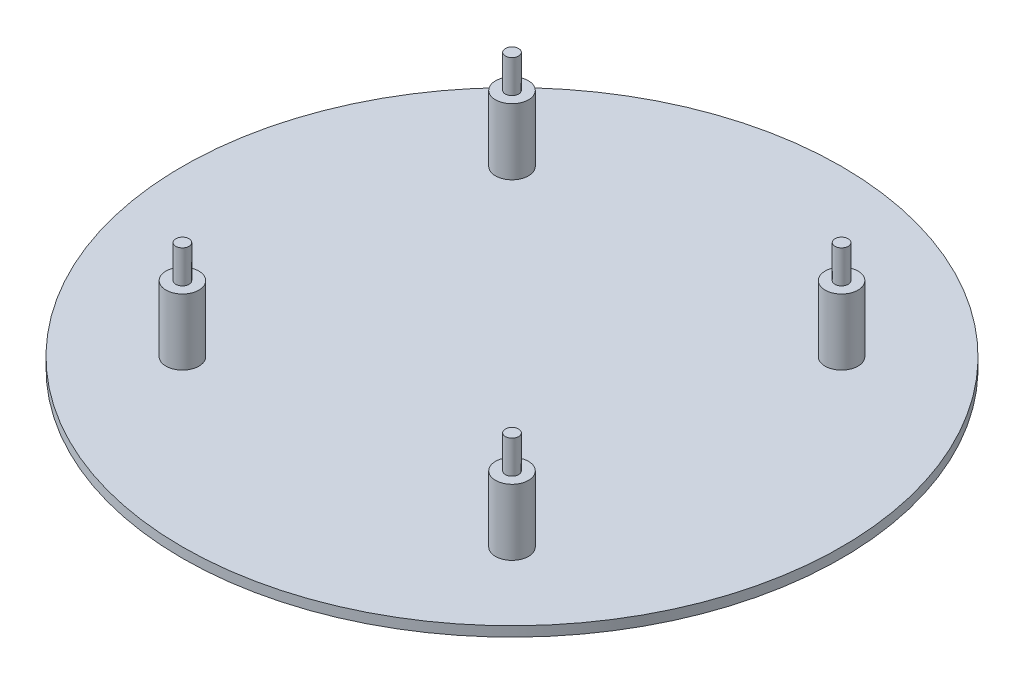
from build123d import *

# Parameters (mm, degrees)
SKETCH3_R           = 100
BOSS_EXTRUDE1_DEPTH = 3
SKETCH4_R           = 5
BOSS_EXTRUDE2_DEPTH = 20
SKETCH5_R           = 2
BOSS_EXTRUDE3_DEPTH = 10


with BuildPart() as part:
    # Sketch3 → Boss-Extrude1 (new body)
    with BuildSketch(Plane(origin=(0, 0, 0), x_dir=(1, 0, 0), z_dir=(0, 1, 0))):
        with Locations(Location((0, 0, 0), (0, 0, 270))):
            Circle(SKETCH3_R)
    extrude(amount=BOSS_EXTRUDE1_DEPTH)

    # Sketch4 → Boss-Extrude2 (add)
    with BuildSketch(Plane(origin=(0, 3, 0), x_dir=(1, 0, 0), z_dir=(0, 1, 0))):
        with Locations(Location((-50, 50, 0), (0, 0, 270))):
            Circle(SKETCH4_R)
        with Locations(Location((50, 50, 0), (0, 0, 270))):
            Circle(SKETCH4_R)
        with Locations(Location((50, -50, 0), (0, 0, 270))):
            Circle(SKETCH4_R)
        with Locations(Location((-50, -50, 0), (0, 0, 270))):
            Circle(SKETCH4_R)
    extrude(amount=BOSS_EXTRUDE2_DEPTH)

    # Sketch5 → Boss-Extrude3 (add)
    with BuildSketch(Plane(origin=(0, 23, 0), x_dir=(1, 0, 0), z_dir=(0, 1, 0))):
        with Locations(Location((50, -50, 0), (0, 0, 270))):
            Circle(SKETCH5_R)
        with Locations(Location((-50, -50, 0), (0, 0, 270))):
            Circle(SKETCH5_R)
        with Locations(Location((-50, 50, 0), (0, 0, 270))):
            Circle(SKETCH5_R)
        with Locations(Location((50, 50, 0), (0, 0, 270))):
            Circle(SKETCH5_R)
    extrude(amount=BOSS_EXTRUDE3_DEPTH)


solid = part.part
